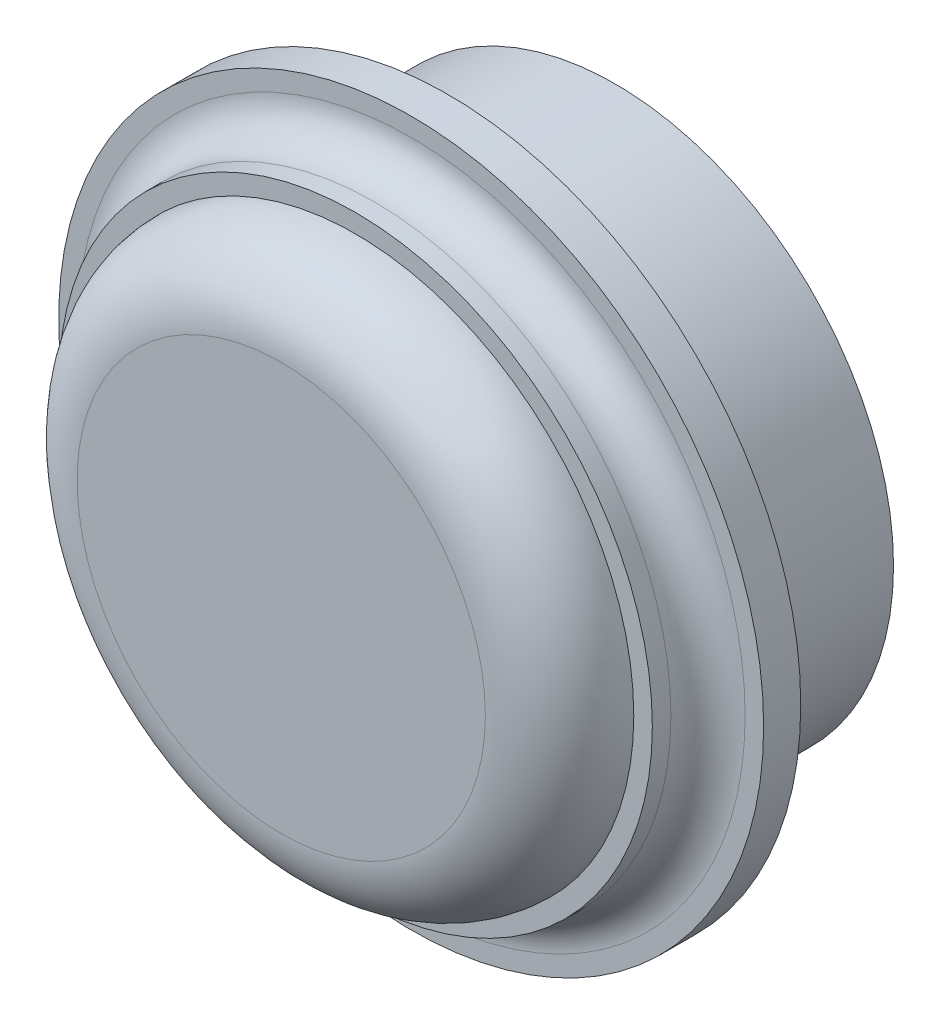
from build123d import *

# Parameters (mm, degrees)
SKETCH1_R                = 95
SKETCH1_R_2              = 75
BOSS_EXTRUDE1_DEPTH      = 10
SURFACE_EXTRUDE1_1_DEPTH = 15
THICKEN1_T2              = 5
SKETCH4_R                = 75
BOSS_EXTRUDE2_DEPTH      = 45
FILLET1_R                = 20
SKETCH4_2_R              = 75
BOSS_EXTRUDE3_DEPTH      = 45
FILLET2_R                = 10


with BuildPart() as part:
    # Sketch1 → Boss-Extrude1 (new body)
    with BuildSketch(Plane.XY):
        Circle(SKETCH1_R)
        Circle(SKETCH1_R_2, mode=Mode.SUBTRACT)
    extrude(amount=BOSS_EXTRUDE1_DEPTH)

    # Surface-Extrude1: a surface, the sketch's curves swept straight by 15 mm
    with BuildLine(Plane.XY.offset(10), mode=Mode.PRIVATE) as surface_extrude1_1_path:
        CenterArc((0, 0), 75, 0, 360)
    surface_extrude1_1 = Shell.extrude(surface_extrude1_1_path.wire(), (0 * SURFACE_EXTRUDE1_1_DEPTH, 0 * SURFACE_EXTRUDE1_1_DEPTH, 1 * SURFACE_EXTRUDE1_1_DEPTH))
    add(Solid.thicken(surface_extrude1_1, -THICKEN1_T2))

    # Fillet2
    fillet2_edges = [part.edges().sort_by_distance(p)[0] for p in [
        (-80, 0, 10),
    ]]
    fillet(fillet2_edges, radius=FILLET2_R)


with BuildPart() as body_2:
    # Sketch4 → Boss-Extrude2 (new body)
    with BuildSketch(Plane.XY):
        with Locations(Location((0, 0, 0), (0, 0, 180))):
            Circle(SKETCH4_R)
    extrude(amount=BOSS_EXTRUDE2_DEPTH)

    # Fillet1
    fillet1_edges = [body_2.edges().sort_by_distance(p)[0] for p in [
        (75, 0, 45),
    ]]
    fillet(fillet1_edges, radius=FILLET1_R)


with BuildPart() as body_3:
    # Sketch4<2> → Boss-Extrude3 (new body)
    with BuildSketch(Plane.XY):
        Circle(SKETCH4_2_R)
    extrude(amount=-BOSS_EXTRUDE3_DEPTH)


solid = Compound([part.part, body_2.part, body_3.part])
